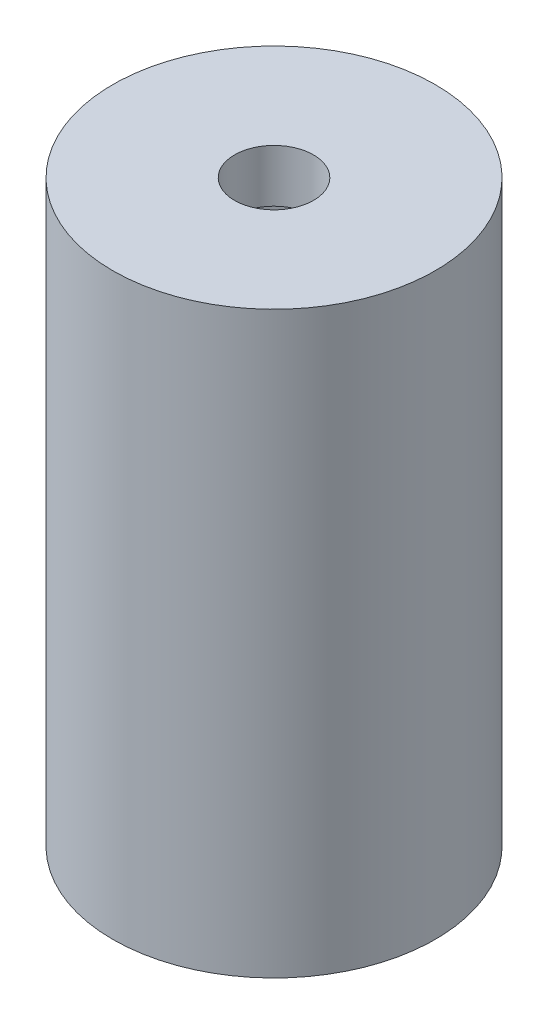
from build123d import *

# Parameters (mm, degrees)
SALIENTE_EXTRUIR1_DEPTH = 40
CROQUIS2_R              = 12.25
SALIENTE_EXTRUIR2_DEPTH = 4
CROQUIS3_R              = 3
CORTAR_EXTRUIR1_DEPTH   = 4


with BuildPart() as part:
    # Croquis1 → Saliente-Extruir1 (new body)
    with BuildSketch(Plane(origin=(0, 0, 0), x_dir=(1, 0, 0), z_dir=(0, 1, 0))):
        with BuildLine():
            Line((-3, 11.87697352), (-3, 8.485281374))
            ThreePointArc((-3, 8.485281374), (0, -9), (3, 8.485281374))
            Line((3, 8.485281374), (3, 11.87697352))
            ThreePointArc((3, 11.87697352), (0, -12.25), (-3, 11.87697352))
        make_face()
    extrude(amount=SALIENTE_EXTRUIR1_DEPTH)

    # Croquis2 → Saliente-Extruir2 (add)
    with BuildSketch(Plane(origin=(0, 40, 0), x_dir=(1, 0, 0), z_dir=(0, 1, 0))):
        with Locations(Location((0, 0, 0), (0, 0, 75.824196484))):
            Circle(CROQUIS2_R)
    extrude(amount=SALIENTE_EXTRUIR2_DEPTH)

    # Croquis3 → Cortar-Extruir1 (cut)
    with BuildSketch(Plane(origin=(0, 44, 0), x_dir=(1, 0, 0), z_dir=(0, 1, 0))):
        with Locations(Location((0, 0, 0), (0, 0, 270))):
            Circle(CROQUIS3_R)
    extrude(amount=-CORTAR_EXTRUIR1_DEPTH, mode=Mode.SUBTRACT)


solid = part.part
